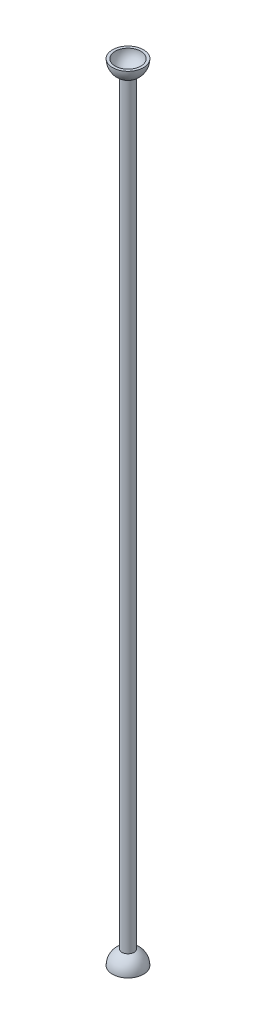
from build123d import *

# Parameters (mm, degrees)
SKETCH1_R           = 2
BOSS_EXTRUDE1_DEPTH = 250


with BuildPart() as part:
    # Sketch1 → Boss-Extrude1 (new body)
    with BuildSketch(Plane(origin=(0, 0, 0), x_dir=(1, 0, 0), z_dir=(0, 1, 0))):
        with Locations(Location((0, 0, 0), (0, 0, 270))):
            Circle(SKETCH1_R)
    extrude(amount=BOSS_EXTRUDE1_DEPTH)

    # Sketch2 → Revolve1 (revolve)
    with BuildSketch(Plane.XY):
        with BuildLine():
            Line((4.25, 254.7141137), (5.120826884, 254.7141137))
            ThreePointArc((5.120826884, 254.7141137), (3.620971415, 251.093142285), (0, 249.593286816))
            Line((0, 249.593286816), (0, 250.4641137))
            ThreePointArc((0, 250.4641137), (3.00520382, 251.70890988), (4.25, 254.7141137))
        make_face()
    revolve1 = revolve(axis=Axis((0, 250.4641137, 0), (0, -1, 0)))

    # Mirror1: Revolve1 across plane
    add(revolve1.mirror(Plane(origin=(0, 125, 0), x_dir=(0, 0, 1), z_dir=(0, -1, 0))))


solid = part.part
